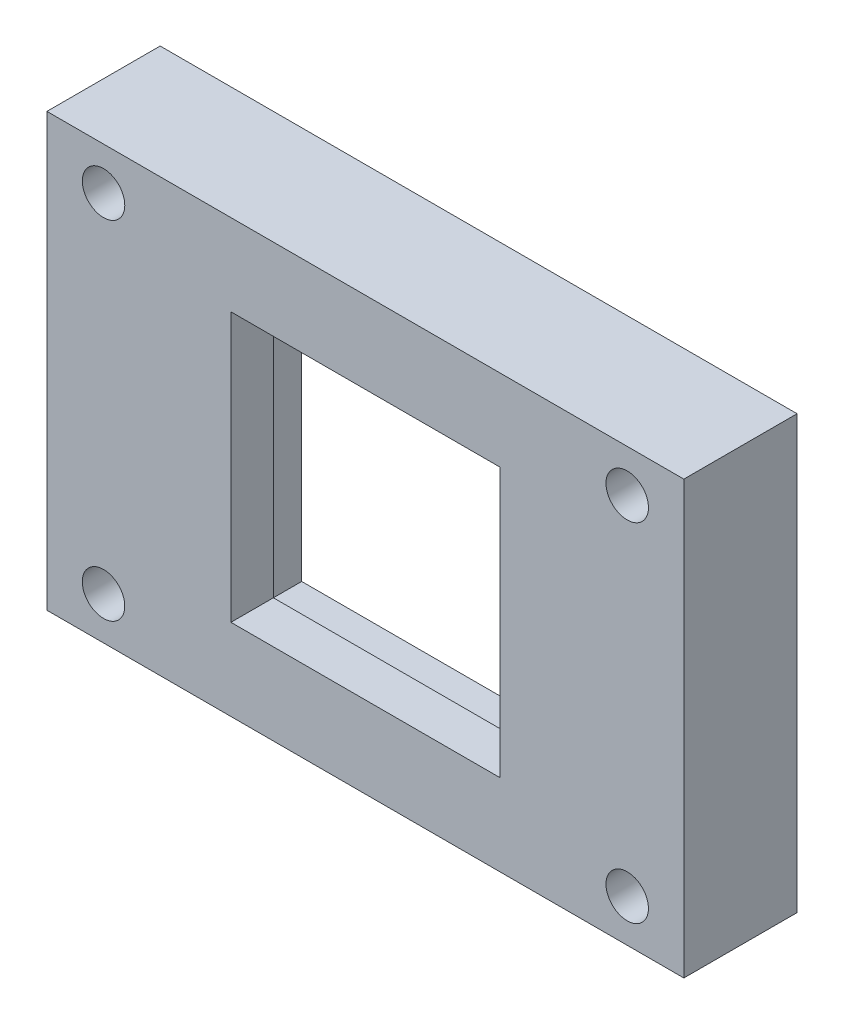
from build123d import *

# Parameters (mm, degrees)
SKETCH1_W               = 45
SKETCH1_H               = 30.527185319
SKETCH1_W_2             = 25
SKETCH1_H_2             = 25
BOSS_EXTRUDE1_DEPTH     = 10
SKETCH2_W               = 5
SKETCH2_H               = 25
BOSS_EXTRUDE2_DEPTH     = 3
SKETCH3_W               = 5
SKETCH3_H               = 25
BOSS_EXTRUDE3_DEPTH     = 3
SKETCH4_W               = 19
SKETCH4_H               = 5
BOSS_EXTRUDE4_DEPTH     = 3
SKETCH5_W               = 19
SKETCH5_H               = 5
BOSS_EXTRUDE5_DEPTH     = 3
SKETCH6_R               = 1.5
CUT_EXTRUDE1_DEPTH      = 56.289321243
CUT_EXTRUDE2_DEPTH      = 56.289321243
CUT_EXTRUDE2_DEPTH_BACK = 56.289321243
SKETCH7_W               = 2
SKETCH7_H               = 30.527185319


with BuildPart() as part:
    # Sketch1 → Boss-Extrude1 (new body)
    with BuildSketch(Plane.XY):
        with Locations((22.5, 15.26359266)):
            Rectangle(SKETCH1_W, SKETCH1_H)
        with Locations((22.5, 15.26359266)):
            Rectangle(SKETCH1_W_2, SKETCH1_H_2, mode=Mode.SUBTRACT)
    extrude(amount=BOSS_EXTRUDE1_DEPTH)

    # Sketch2 → Boss-Extrude2 (add)
    with BuildSketch(Plane(origin=(10, 0, 0), x_dir=(0, 0, -1), z_dir=(1, 0, 0))):
        with Locations((-7.5, 15.26359266)):
            Rectangle(SKETCH2_W, SKETCH2_H)
    extrude(amount=BOSS_EXTRUDE2_DEPTH)

    # Sketch3 → Boss-Extrude3 (add)
    with BuildSketch(Plane.ZY.offset(-35)):
        with Locations((7.5, 15.26359266)):
            Rectangle(SKETCH3_W, SKETCH3_H)
    extrude(amount=BOSS_EXTRUDE3_DEPTH)

    # Sketch4 → Boss-Extrude4 (add)
    with BuildSketch(Plane.XZ.offset(-27.76359266)):
        with Locations((22.5, 7.5)):
            Rectangle(SKETCH4_W, SKETCH4_H)
    extrude(amount=BOSS_EXTRUDE4_DEPTH)

    # Sketch5 → Boss-Extrude5 (add)
    with BuildSketch(Plane(origin=(0, 2.76359266, 0), x_dir=(1, 0, 0), z_dir=(0, 1, 0))):
        with Locations((22.5, -7.5)):
            Rectangle(SKETCH5_W, SKETCH5_H)
    extrude(amount=BOSS_EXTRUDE5_DEPTH)

    # Sketch6 → Cut-Extrude1 (cut, through all)
    with BuildSketch(Plane.XY.offset(10)):
        with Locations((4, 27.527185319)):
            Circle(SKETCH6_R)
        with Locations((41, 27.527185319)):
            Circle(SKETCH6_R)
        with Locations(Location((41, 3, 0), (0, 0, 180))):
            Circle(SKETCH6_R)
        with Locations(Location((4, 3, 0), (0, 0, 180))):
            Circle(SKETCH6_R)
    extrude(amount=-CUT_EXTRUDE1_DEPTH, mode=Mode.SUBTRACT)

    # Sketch7 → Cut-Extrude2 (cut, two sides: drawn at the far end of the back side and taken through both)
    with BuildSketch(Plane(origin=(45, 0, 0), x_dir=(0, 0, -1), z_dir=(1, 0, 0)).offset(-CUT_EXTRUDE2_DEPTH_BACK)):
        with Locations((-9, 15.26359266)):
            Rectangle(SKETCH7_W, SKETCH7_H)
    extrude(amount=CUT_EXTRUDE2_DEPTH + CUT_EXTRUDE2_DEPTH_BACK, mode=Mode.SUBTRACT)


solid = part.part
